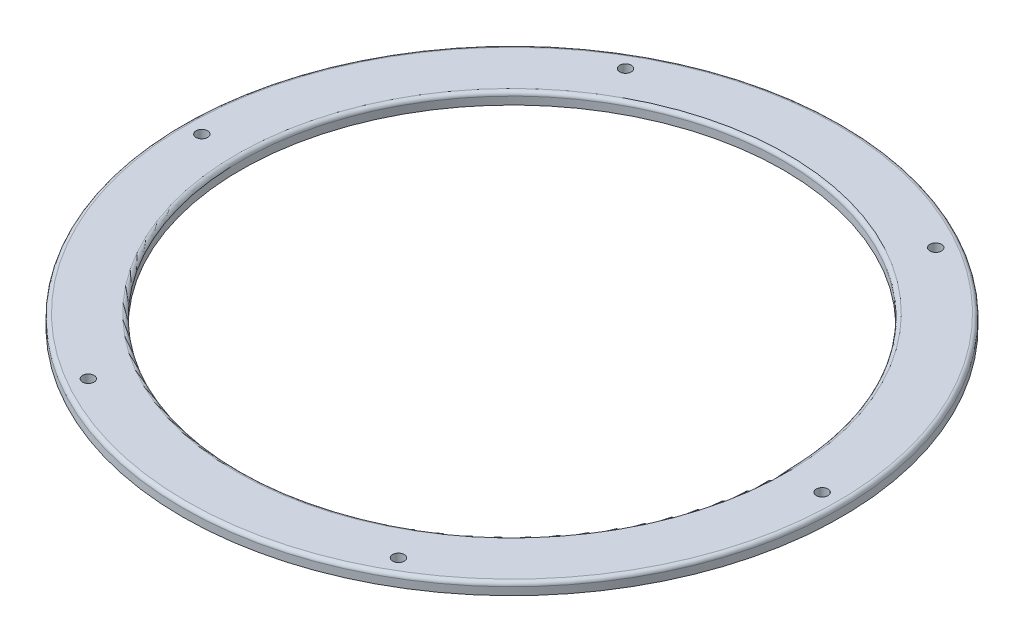
from build123d import *

# Parameters (mm, degrees)
ESQUISSE1_R                  = 85
BOSS_EXTRU_1_DEPTH           = 3
ESQUISSE2_R                  = 70
ENL_V_MAT_EXTRU_1_DEPTH      = 3
ESQUISSE3_R                  = 1.5
ENL_V_MAT_EXTRU_2_DEPTH      = 3
R_P_TITION_CIRCULAIRE1_COUNT = 6
CONG_1_R                     = 1


with BuildPart() as part:
    # Esquisse1 → Boss.-Extru.1 (new body)
    with BuildSketch(Plane(origin=(0, 0, 0), x_dir=(1, 0, 0), z_dir=(0, 1, 0))):
        with Locations(Location((0, 0, 0), (0, 0, 270))):
            Circle(ESQUISSE1_R)
    extrude(amount=BOSS_EXTRU_1_DEPTH)

    # Esquisse2 → Enlèv. mat.-Extru.1 (cut)
    with BuildSketch(Plane(origin=(0, 3, 0), x_dir=(1, 0, 0), z_dir=(0, 1, 0))):
        with Locations(Location((0, 0, 0), (0, 0, 270))):
            Circle(ESQUISSE2_R)
    extrude(amount=-ENL_V_MAT_EXTRU_1_DEPTH, mode=Mode.SUBTRACT)

    # Esquisse3 → Enlèv. mat.-Extru.2 (cut)
    with BuildSketch(Plane(origin=(0, 3, 0), x_dir=(1, 0, 0), z_dir=(0, 1, 0))):
        with Locations(Location((80, 0, 0), (0, 0, 270))):
            Circle(ESQUISSE3_R)
    enl_v_mat_extru_2 = extrude(amount=-ENL_V_MAT_EXTRU_2_DEPTH, mode=Mode.SUBTRACT)

    # Répétition circulaire1: Enlèv. mat.-Extru.2 ×6 about axis
    r_p_tition_circulaire1_axis = Axis((0, 0, 0), (0, 1, 0))
    for i in range(1, R_P_TITION_CIRCULAIRE1_COUNT):
        add(enl_v_mat_extru_2.rotate(r_p_tition_circulaire1_axis, i * 360 / R_P_TITION_CIRCULAIRE1_COUNT), mode=Mode.SUBTRACT)

    # Congé1
    cong_1_edges = [part.edges().sort_by_distance(p)[0] for p in [
        (0, 3, -85),
        (0, 3, -70),
    ]]
    fillet(cong_1_edges, radius=CONG_1_R)


solid = part.part
